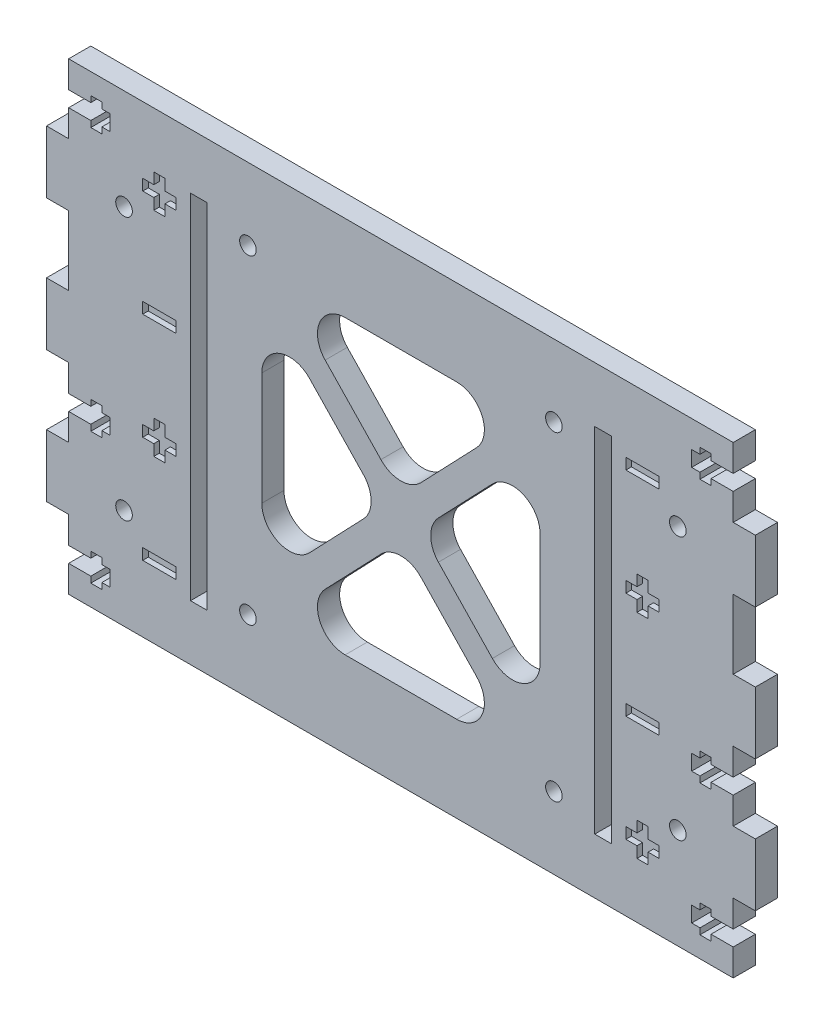
from build123d import *

# Parameters (mm, degrees)
SKETCH_1_W          = 120
SKETCH_1_H          = 83.75
SKETCH_1_W_2        = 4
SKETCH_1_H_2        = 11.25
EXTRUDE_1_DEPTH     = 4
SKETCH_2_W          = 7.5
SKETCH_2_H          = 2.8
SKETCH_2_W_2        = 2
SKETCH_2_H_2        = 5
CUT_EXTRUDE_1_DEPTH = 4
SKETCH_3_W          = 3
SKETCH_3_H          = 63.75
SKETCH_3_R          = 1.5
CUT_EXTRUDE_2_DEPTH = 77.586654353
FILLET_1_R          = 5
SKETCH_4_W          = 6
SKETCH_4_H          = 2
SKETCH_4_W_2        = 2
SKETCH_4_H_2        = 6
CUT_EXTRUDE_3_DEPTH = 1


with BuildPart() as part:
    # Эскиз1 → Бобышка-Вытянуть1 (new body)
    with BuildSketch(Plane.XY):
        Rectangle(SKETCH_1_W, SKETCH_1_H)
        with Locations((-62, -23.75)):
            Rectangle(SKETCH_1_W_2, SKETCH_1_H_2)
        with Locations((-62, 23.75)):
            Rectangle(SKETCH_1_W_2, SKETCH_1_H_2)
        with Locations((62, 23.75)):
            Rectangle(SKETCH_1_W_2, SKETCH_1_H_2)
        with Locations((62, -23.75)):
            Rectangle(SKETCH_1_W_2, SKETCH_1_H_2)
        with Locations((-62, 0)):
            Rectangle(SKETCH_1_W_2, SKETCH_1_H_2)
        with Locations((62, 0)):
            Rectangle(SKETCH_1_W_2, SKETCH_1_H_2)
    extrude(amount=EXTRUDE_1_DEPTH)

    # Эскиз2 → Вырез-Вытянуть1 (cut)
    with BuildSketch(Plane.XY.offset(4)):
        with Locations((-56.25, 35.625)):
            Rectangle(SKETCH_2_W, SKETCH_2_H)
        with Locations((-55, 35.625)):
            Rectangle(SKETCH_2_W_2, SKETCH_2_H_2)
        with Locations((-55, -35.625)):
            Rectangle(SKETCH_2_W_2, SKETCH_2_H_2)
        with Locations((-56.25, -35.625)):
            Rectangle(SKETCH_2_W, SKETCH_2_H)
        with Locations((-56.25, -11.875)):
            Rectangle(SKETCH_2_W, SKETCH_2_H)
        with Locations((-55, -11.875)):
            Rectangle(SKETCH_2_W_2, SKETCH_2_H_2)
        with Locations((55, -11.875)):
            Rectangle(SKETCH_2_W_2, SKETCH_2_H_2)
        with Locations((56.25, -11.875)):
            Rectangle(SKETCH_2_W, SKETCH_2_H)
        with Locations((56.25, -35.625)):
            Rectangle(SKETCH_2_W, SKETCH_2_H)
        with Locations((55, -35.625)):
            Rectangle(SKETCH_2_W_2, SKETCH_2_H_2)
        with Locations((55, 35.625)):
            Rectangle(SKETCH_2_W_2, SKETCH_2_H_2)
        with Locations((56.25, 35.625)):
            Rectangle(SKETCH_2_W, SKETCH_2_H)
    extrude(amount=-CUT_EXTRUDE_1_DEPTH, mode=Mode.SUBTRACT)

    # Эскиз3 → Вырез-Вытянуть2 (cut, through all)
    with BuildSketch(Plane.XY.offset(4)):
        with Locations((-36.5, 0)):
            Rectangle(SKETCH_3_W, SKETCH_3_H)
        with Locations((36.5, 0)):
            Rectangle(SKETCH_3_W, SKETCH_3_H)
        Polygon((-25.125, 22.645469736), (-25.125, -22.645469736), (-3.459853629, 0), align=None)
        Polygon((21.773371479, 26.375), (-21.773371479, 26.375), (0, 3.616408092), align=None)
        Polygon((21.773371479, -26.375), (0, -3.616408092), (-21.773371479, -26.375), align=None)
        Polygon((25.125, -22.645469736), (25.125, 22.645469736), (3.459853629, 0), align=None)
        with Locations((-27.625, 28.875)):
            Circle(SKETCH_3_R)
        with Locations((27.625, 28.875)):
            Circle(SKETCH_3_R)
        with Locations((27.625, -28.875)):
            Circle(SKETCH_3_R)
        with Locations((-27.625, -28.875)):
            Circle(SKETCH_3_R)
        with Locations((50, -23.75)):
            Circle(SKETCH_3_R)
        with Locations(Location((50, 23.75, 0), (0, 0, 180))):
            Circle(SKETCH_3_R)
        with Locations((-50, 23.75)):
            Circle(SKETCH_3_R)
        with Locations(Location((-50, -23.75, 0), (0, 0, 180))):
            Circle(SKETCH_3_R)
    extrude(amount=-CUT_EXTRUDE_2_DEPTH, mode=Mode.SUBTRACT)

    # Скругление1
    fillet_1_edges = [part.edges().sort_by_distance(p)[0] for p in [
        (-21.773371479, -26.375, 2),
        (0, -3.616408092, 2),
        (21.773371479, -26.375, 2),
        (-3.459853629, 0, 2),
        (-25.125, -22.645469736, 2),
        (-25.125, 22.645469736, 2),
        (25.125, -22.645469736, 2),
        (3.459853629, 0, 2),
        (25.125, 22.645469736, 2),
        (0, 3.616408092, 2),
        (-21.773371479, 26.375, 2),
        (21.773371479, 26.375, 2),
    ]]
    fillet(fillet_1_edges, radius=FILLET_1_R)

    # Эскиз4 → Вырез-Вытянуть3 (cut)
    with BuildSketch(Plane.XY.offset(4)):
        with Locations((-43.625, 9.625)):
            Rectangle(SKETCH_4_W, SKETCH_4_H)
        with Locations((-43.625, 28.875)):
            Rectangle(SKETCH_4_W, SKETCH_4_H)
        with Locations((-43.625, 28.875)):
            Rectangle(SKETCH_4_W_2, SKETCH_4_H_2)
        with Locations((-43.625, -9.625)):
            Rectangle(SKETCH_4_W, SKETCH_4_H)
        with Locations((-43.625, -9.625)):
            Rectangle(SKETCH_4_W_2, SKETCH_4_H_2)
        with Locations((-43.625, -28.875)):
            Rectangle(SKETCH_4_W, SKETCH_4_H)
        with Locations((43.625, -28.875)):
            Rectangle(SKETCH_4_W_2, SKETCH_4_H_2)
        with Locations((43.625, -28.875)):
            Rectangle(SKETCH_4_W, SKETCH_4_H)
        with Locations((43.625, -9.625)):
            Rectangle(SKETCH_4_W, SKETCH_4_H)
        with Locations((43.625, 9.625)):
            Rectangle(SKETCH_4_W_2, SKETCH_4_H_2)
        with Locations((43.625, 9.625)):
            Rectangle(SKETCH_4_W, SKETCH_4_H)
        with Locations((43.625, 28.875)):
            Rectangle(SKETCH_4_W, SKETCH_4_H)
    extrude(amount=-CUT_EXTRUDE_3_DEPTH, mode=Mode.SUBTRACT)


solid = part.part
